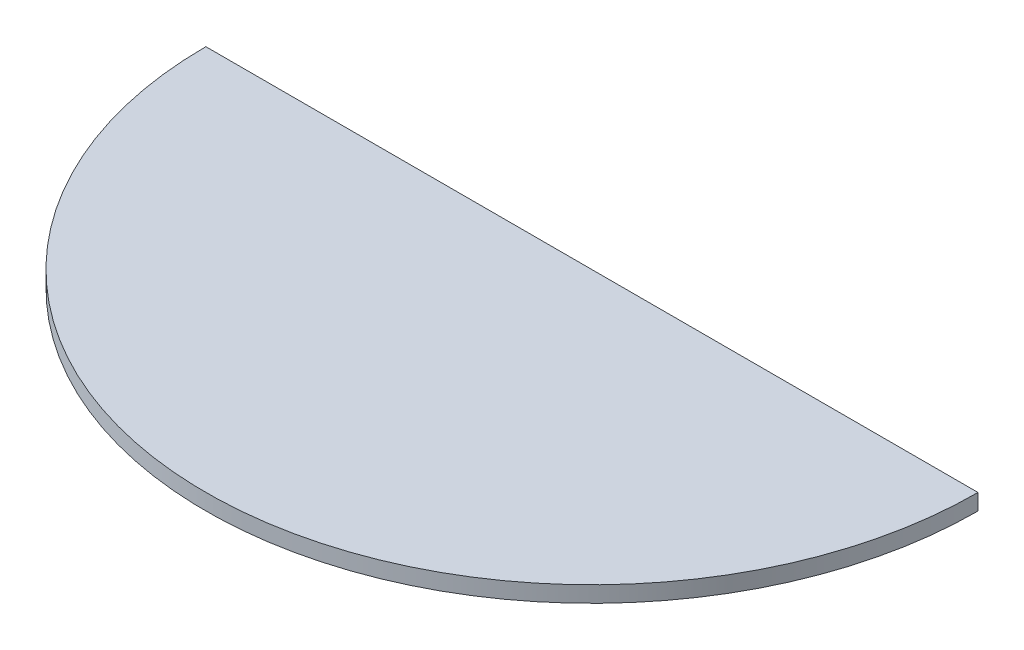
from build123d import *

# Parameters (mm, degrees)
SKETCH2_W      = 152.4
SKETCH2_H      = 6.35
REVOLVE1_ANGLE = 180


with BuildPart() as part:
    # Sketch2 → Revolve1 (revolve)
    with BuildSketch(Plane.XY):
        with Locations((-76.2, 3.175)):
            Rectangle(SKETCH2_W, SKETCH2_H)
    revolve(axis=Axis((0, 0, 0), (0, 1, 0)), revolution_arc=REVOLVE1_ANGLE)


solid = part.part
